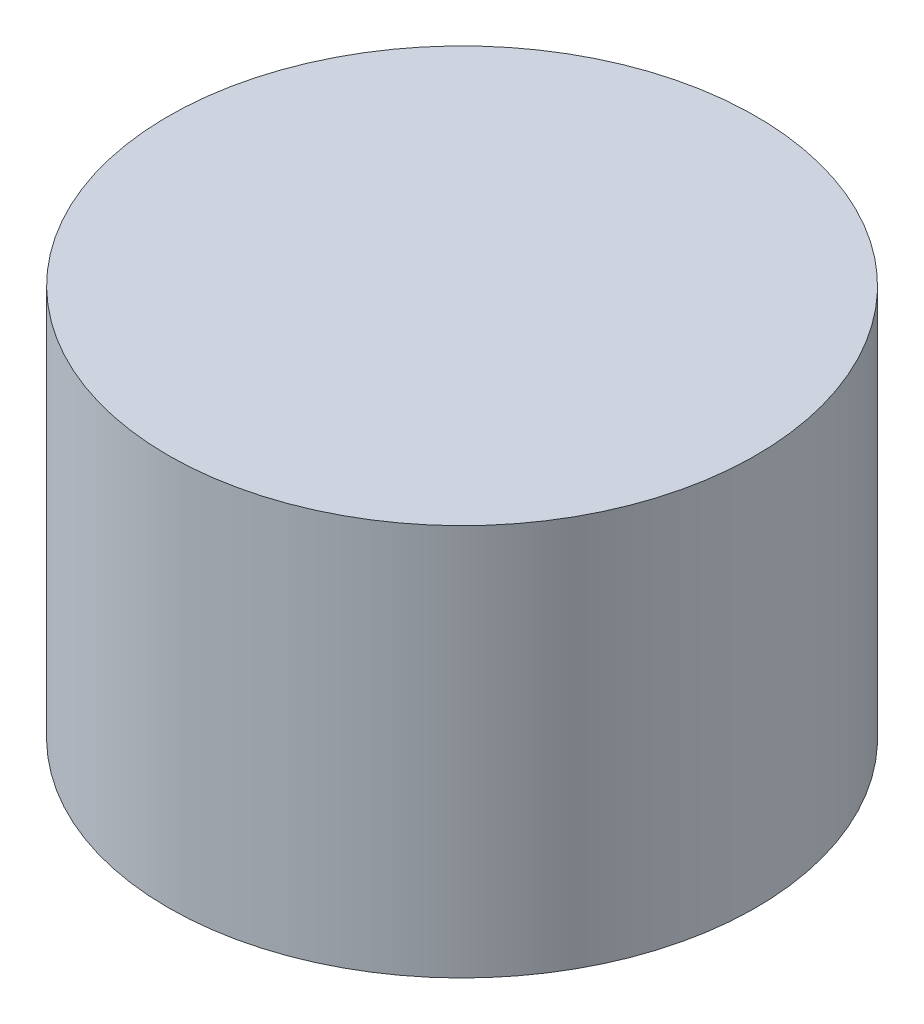
from build123d import *

# Parameters (mm, degrees)
SKETCH1_R           = 4.5
BOSS_EXTRUDE1_DEPTH = 6


with BuildPart() as part:
    # Sketch1 → Boss-Extrude1 (new body)
    with BuildSketch(Plane(origin=(0, 0, 0), x_dir=(1, 0, 0), z_dir=(0, 1, 0))):
        with Locations(Location((0, 0, 0), (0, 0, 270))):
            Circle(SKETCH1_R)
    extrude(amount=BOSS_EXTRUDE1_DEPTH)


solid = part.part
